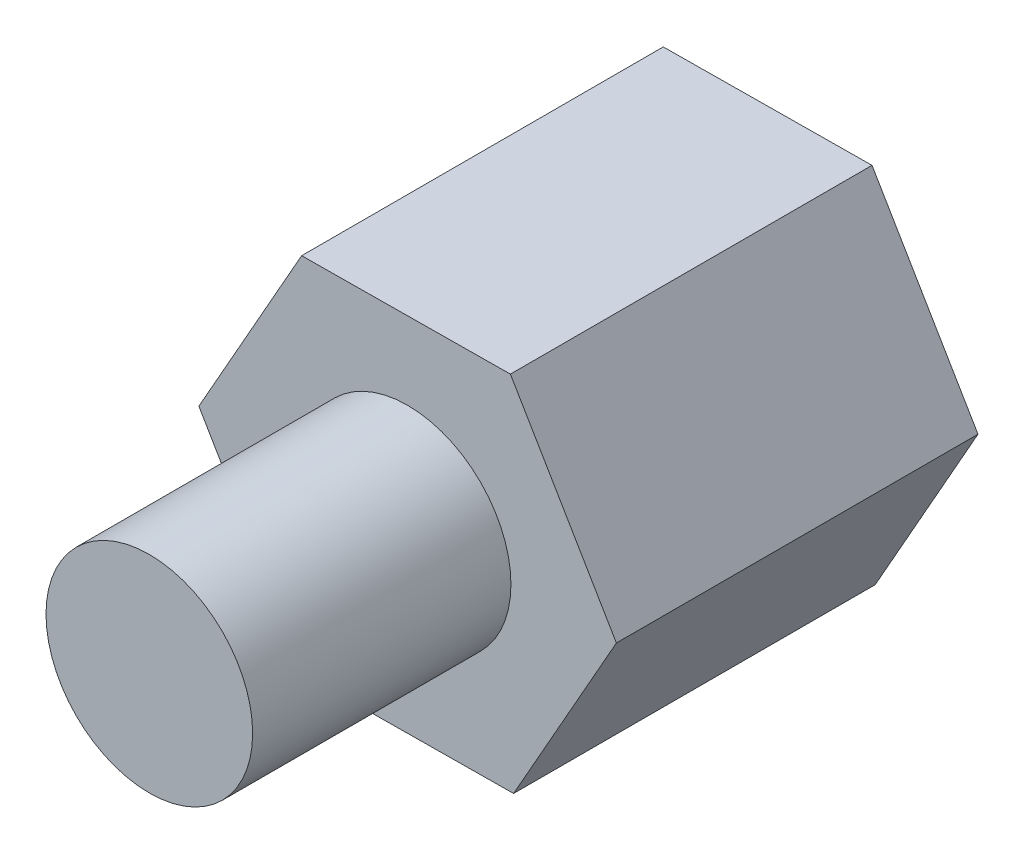
from build123d import *

# Parameters (mm, degrees)
SKETCH_1_R      = 2
EXTRUDE_1_DEPTH = 7
SKETCH_3_R      = 2
EXTRUDE_2_DEPTH = 5


with BuildPart() as part:
    # 草图1 → 凸台-拉伸1 (new body)
    with BuildSketch(Plane.XY):
        Polygon((2.051456248, -3.482077052), (4.041295309, 0.035574699), (1.989839061, 3.517651751), (-2.051456248, 3.482077052), (-4.041295309, -0.035574699), (-1.989839061, -3.517651751), align=None)
        Circle(SKETCH_1_R, mode=Mode.SUBTRACT)
    extrude(amount=EXTRUDE_1_DEPTH)


with BuildPart() as body_2:
    # 草图3 → 凸台-拉伸2 (new body)
    with BuildSketch(Plane.XY.offset(7)):
        Circle(SKETCH_3_R)
    extrude(amount=EXTRUDE_2_DEPTH)


solid = Compound([part.part, body_2.part])
